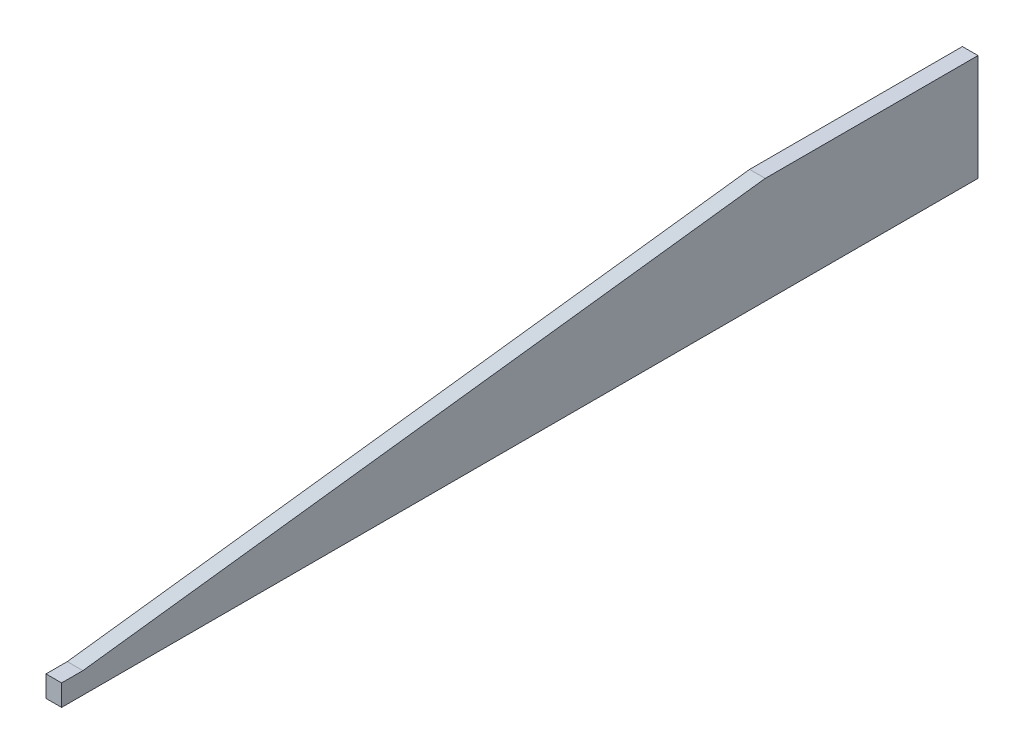
from build123d import *

# Parameters (mm, degrees)
ESQUISSE1_W             = 22
ESQUISSE1_H             = 150
BOSS_EXTRU_1_DEPTH      = 1292
ENL_V_MAT_EXTRU_1_DEPTH = 1295.362005005


with BuildPart() as part:
    # Esquisse1 → Boss.-Extru.1 (new body)
    with BuildSketch(Plane.XY):
        Rectangle(ESQUISSE1_W, ESQUISSE1_H)
    extrude(amount=BOSS_EXTRU_1_DEPTH)

    # Esquisse2 → Enlèv. mat.-Extru.1 (cut, through all)
    with BuildSketch(Plane(origin=(11, 0, 0), x_dir=(0, 0, -1), z_dir=(1, 0, 0))):
        Polygon((-300, 75), (-1262, -45), (-1292, -45), (-1292, 75), align=None)
    extrude(amount=-ENL_V_MAT_EXTRU_1_DEPTH, mode=Mode.SUBTRACT)


solid = part.part
